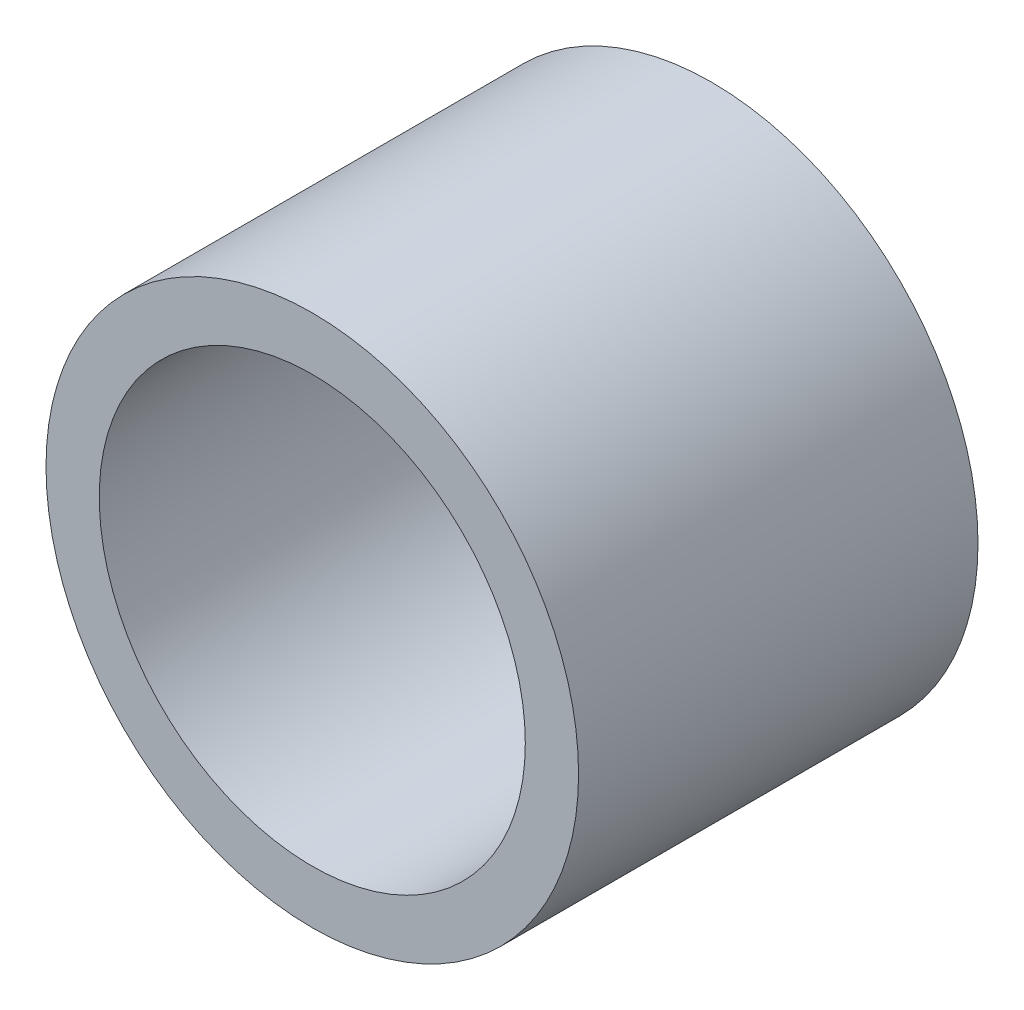
from build123d import *

# Parameters (mm, degrees)
SKETCH1_R           = 5
SKETCH1_R_2         = 4
BOSS_EXTRUDE1_DEPTH = 7.5


with BuildPart() as part:
    # Sketch1 → Boss-Extrude1 (new body)
    with BuildSketch(Plane.XY):
        with Locations((213.803411798, -339.866155144)):
            Circle(SKETCH1_R)
        with Locations((213.803411798, -339.866155144)):
            Circle(SKETCH1_R_2, mode=Mode.SUBTRACT)
    extrude(amount=BOSS_EXTRUDE1_DEPTH)


solid = part.part
